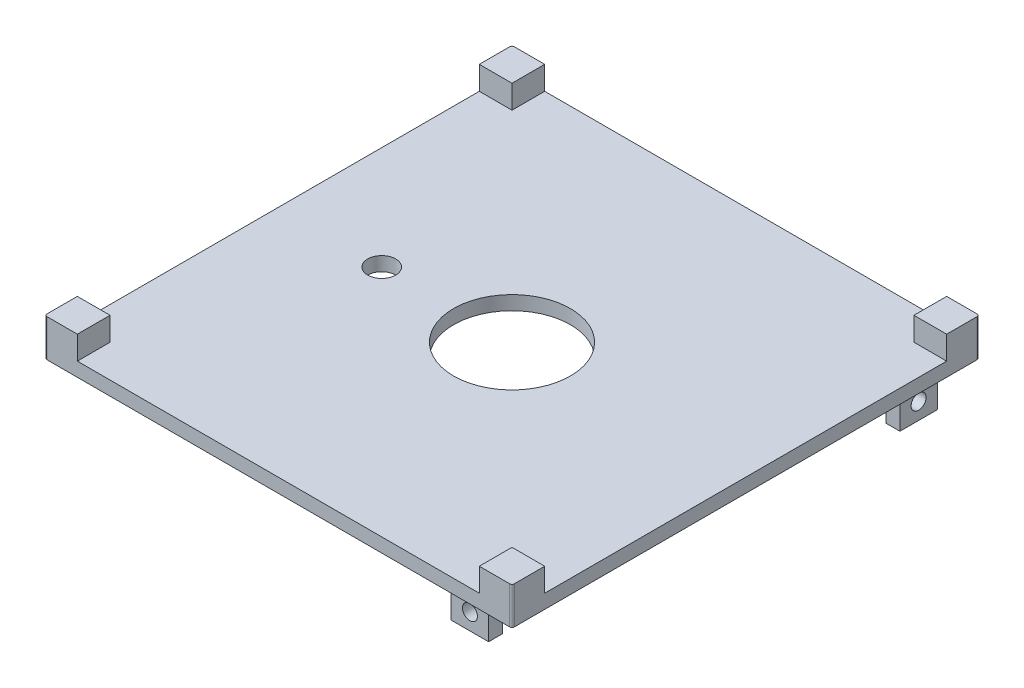
from build123d import *

# Parameters (mm, degrees)
SKETCH2_W           = 100
SKETCH2_H           = 100
SKETCH2_R           = 12.5
BOSS_EXTRUDE1_DEPTH = 3
SKETCH3_W           = 7
SKETCH3_H           = 7
BOSS_EXTRUDE2_DEPTH = 5
SKETCH4_W           = 3
SKETCH4_H           = 8
SKETCH4_W_2         = 8
SKETCH4_H_2         = 3
BOSS_EXTRUDE3_DEPTH = 7
SKETCH5_R           = 1.6
CUT_EXTRUDE1_DEPTH  = 111.308657865
SKETCH8_R           = 1.6
CUT_EXTRUDE4_DEPTH  = 111.308657865
SKETCH9_R           = 3
CUT_EXTRUDE5_DEPTH  = 10
FILLET1_R           = 0.5


with BuildPart() as part:
    # Sketch2 → Boss-Extrude1 (new body)
    with BuildSketch(Plane(origin=(0, 0, 0), x_dir=(1, 0, 0), z_dir=(0, 1, 0))):
        Rectangle(SKETCH2_W, SKETCH2_H)
        with Locations(Location((0, 0, 0), (0, 0, 270))):
            Circle(SKETCH2_R, mode=Mode.SUBTRACT)
    extrude(amount=BOSS_EXTRUDE1_DEPTH)

    # Sketch3 → Boss-Extrude2 (add)
    with BuildSketch(Plane(origin=(0, 3, 0), x_dir=(1, 0, 0), z_dir=(0, 1, 0))):
        with Locations((-46.5, 46.5)):
            Rectangle(SKETCH3_W, SKETCH3_H)
        with Locations((46.5, 46.5)):
            Rectangle(SKETCH3_W, SKETCH3_H)
        with Locations((46.5, -46.5)):
            Rectangle(SKETCH3_W, SKETCH3_H)
        with Locations((-46.5, -46.5)):
            Rectangle(SKETCH3_W, SKETCH3_H)
    extrude(amount=BOSS_EXTRUDE2_DEPTH)

    # Sketch4 → Boss-Extrude3 (add)
    with BuildSketch(Plane.XZ):
        with Locations((46.5, -39)):
            Rectangle(SKETCH4_W, SKETCH4_H)
        with Locations((39, 46.5)):
            Rectangle(SKETCH4_W_2, SKETCH4_H_2)
        with Locations((-46.5, 39)):
            Rectangle(SKETCH4_W, SKETCH4_H)
        with Locations((-39, -46.5)):
            Rectangle(SKETCH4_W_2, SKETCH4_H_2)
    extrude(amount=BOSS_EXTRUDE3_DEPTH)

    # Sketch5 → Cut-Extrude1 (cut, through all)
    with BuildSketch(Plane(origin=(0, 0, -48), x_dir=(-1, 0, 0), z_dir=(0, 0, -1))):
        with Locations((39, -3.5)):
            Circle(SKETCH5_R)
        with Locations((-39, -3.5)):
            Circle(SKETCH5_R)
    extrude(amount=-CUT_EXTRUDE1_DEPTH, mode=Mode.SUBTRACT)

    # Sketch8 → Cut-Extrude4 (cut, through all)
    with BuildSketch(Plane(origin=(48, 0, 0), x_dir=(0, 0, -1), z_dir=(1, 0, 0))):
        with Locations((-39, -3.5)):
            Circle(SKETCH8_R)
        with Locations((39, -3.5)):
            Circle(SKETCH8_R)
    extrude(amount=-CUT_EXTRUDE4_DEPTH, mode=Mode.SUBTRACT)

    # Sketch9 → Cut-Extrude5 (cut)
    with BuildSketch(Plane(origin=(0, 3, 0), x_dir=(1, 0, 0), z_dir=(0, 1, 0))):
        with Locations(Location((-27.876571837, 0, 0), (0, 0, 270))):
            Circle(SKETCH9_R)
    extrude(amount=-CUT_EXTRUDE5_DEPTH, mode=Mode.SUBTRACT)

    # Fillet1
    fillet1_edges = [part.edges().sort_by_distance(p)[0] for p in [
        (-50, 4, 50),
        (-50, 4, -50),
        (50, 4, -50),
        (50, 4, 50),
    ]]
    fillet(fillet1_edges, radius=FILLET1_R)


solid = part.part
